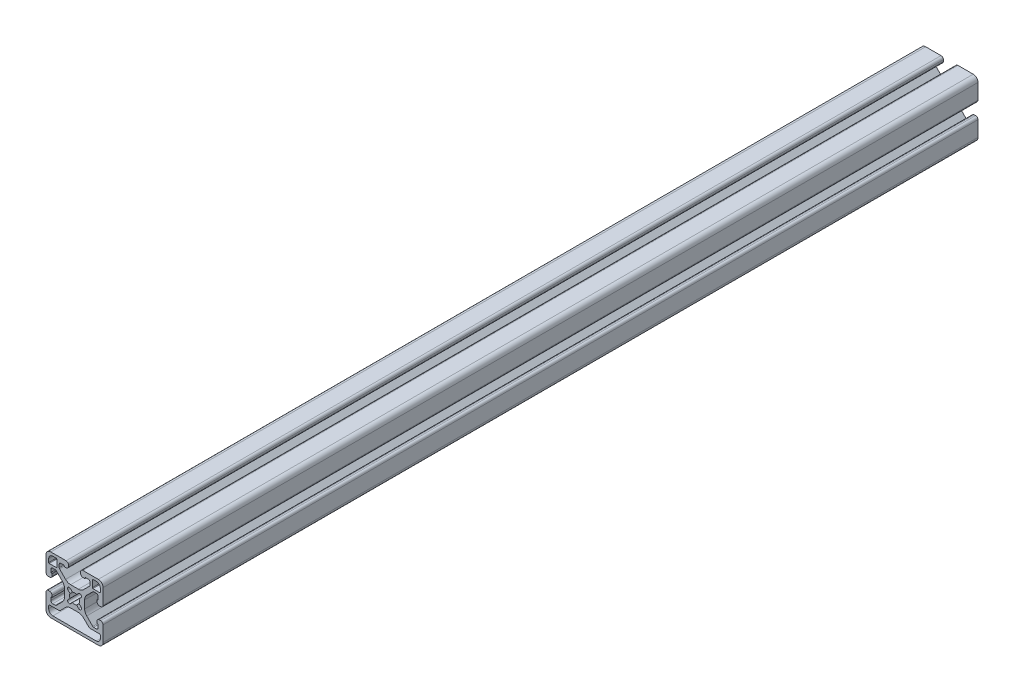
from build123d import *

# Parameters (mm, degrees)
EXTRUDE1_DEPTH     = 292.1
F_7060_LEFT_D      = 6.6548
F_7060_LEFT_DEPTH  = 20.1168
F_7060_LEFT_TIP    = 1.999303624
F_7060_RIGHT_D     = 6.6548
F_7060_RIGHT_DEPTH = 20.1168
F_7060_RIGHT_TIP   = 1.999303624


with BuildPart() as part:
    # Sketch1 → Extrude1 (new, symmetric)
    with BuildSketch(Plane.XY):
        with BuildLine():
            Line((-15.8242, 7.239), (-15.8242, 9.017))
            ThreePointArc((-15.8242, 9.017), (-15.452225612, 9.915025612), (-14.5542, 10.287))
            Line((-14.5542, 10.287), (-12.810497326, 10.287))
            ThreePointArc((-12.810497326, 10.287), (-12.470291755, 10.219328904), (-12.181879398, 10.026617928))
            Line((-12.181879398, 10.026617928), (-8.129198975, 5.973937506))
            ThreePointArc((-8.129198975, 5.973937506), (-7.09957176, 4.432991483), (-6.738014764, 2.615321716))
            Line((-6.738014764, 2.615321716), (-6.738014764, -2.615321716))
            ThreePointArc((-6.738014764, -2.615321716), (-7.09957176, -4.432991483), (-8.129198975, -5.973937506))
            Line((-8.129198975, -5.973937506), (-12.181879398, -10.026617928))
            ThreePointArc((-12.181879398, -10.026617928), (-12.470291755, -10.219328904), (-12.810497326, -10.287))
            Line((-12.810497326, -10.287), (-14.5542, -10.287))
            ThreePointArc((-14.5542, -10.287), (-15.452225612, -9.915025612), (-15.8242, -9.017))
            Line((-15.8242, -9.017), (-15.8242, -7.239))
            ThreePointArc((-15.8242, -7.239), (-15.712607684, -6.969592316), (-15.4432, -6.858))
            Line((-15.4432, -6.858), (-14.986, -6.858))
            Line((-14.986, -6.858), (-14.986, -5.6388))
            ThreePointArc((-14.986, -5.6388), (-15.447248241, -4.525248241), (-16.5608, -4.064))
            Line((-16.5608, -4.064), (-17.4752, -4.064))
            ThreePointArc((-17.4752, -4.064), (-18.588751759, -4.525248241), (-19.05, -5.6388))
            Line((-19.05, -5.6388), (-19.05, -15.875))
            ThreePointArc((-19.05, -15.875), (-18.12006403, -18.12006403), (-15.875, -19.05))
            Line((-15.875, -19.05), (15.875, -19.05))
            ThreePointArc((15.875, -19.05), (18.12006403, -18.12006403), (19.05, -15.875))
            Line((19.05, -15.875), (19.05, -5.6388))
            ThreePointArc((19.05, -5.6388), (18.588751759, -4.525248241), (17.4752, -4.064))
            Line((17.4752, -4.064), (16.5608, -4.064))
            ThreePointArc((16.5608, -4.064), (15.447248241, -4.525248241), (14.986, -5.6388))
            Line((14.986, -5.6388), (14.986, -6.858))
            Line((14.986, -6.858), (15.4432, -6.858))
            ThreePointArc((15.4432, -6.858), (15.712607684, -6.969592316), (15.8242, -7.239))
            Line((15.8242, -7.239), (15.8242, -9.017))
            ThreePointArc((15.8242, -9.017), (15.452225612, -9.915025612), (14.5542, -10.287))
            Line((14.5542, -10.287), (12.810497326, -10.287))
            ThreePointArc((12.810497326, -10.287), (12.470291755, -10.219328904), (12.181879398, -10.026617928))
            Line((12.181879398, -10.026617928), (8.129198975, -5.973937506))
            ThreePointArc((8.129198975, -5.973937506), (7.09957176, -4.432991483), (6.738014764, -2.615321716))
            Line((6.738014764, -2.615321716), (6.738014764, 2.615321716))
            ThreePointArc((6.738014764, 2.615321716), (7.09957176, 4.432991483), (8.129198975, 5.973937506))
            Line((8.129198975, 5.973937506), (12.181879398, 10.026617928))
            ThreePointArc((12.181879398, 10.026617928), (12.470291755, 10.219328904), (12.810497326, 10.287))
            Line((12.810497326, 10.287), (14.5542, 10.287))
            ThreePointArc((14.5542, 10.287), (15.452225612, 9.915025612), (15.8242, 9.017))
            Line((15.8242, 9.017), (15.8242, 7.239))
            ThreePointArc((15.8242, 7.239), (15.712607684, 6.969592316), (15.4432, 6.858))
            Line((15.4432, 6.858), (14.986, 6.858))
            Line((14.986, 6.858), (14.986, 5.6388))
            ThreePointArc((14.986, 5.6388), (15.447248241, 4.525248241), (16.5608, 4.064))
            Line((16.5608, 4.064), (17.4752, 4.064))
            ThreePointArc((17.4752, 4.064), (18.588751759, 4.525248241), (19.05, 5.6388))
            Line((19.05, 5.6388), (19.05, 15.875))
            ThreePointArc((19.05, 15.875), (18.12006403, 18.12006403), (15.875, 19.05))
            Line((15.875, 19.05), (5.6388, 19.05))
            ThreePointArc((5.6388, 19.05), (4.525248241, 18.588751759), (4.064, 17.4752))
            Line((4.064, 17.4752), (4.064, 16.5608))
            ThreePointArc((4.064, 16.5608), (4.525248241, 15.447248241), (5.6388, 14.986))
            Line((5.6388, 14.986), (6.858, 14.986))
            Line((6.858, 14.986), (6.858, 15.4432))
            ThreePointArc((6.858, 15.4432), (6.969592316, 15.712607684), (7.239, 15.8242))
            Line((7.239, 15.8242), (9.017, 15.8242))
            ThreePointArc((9.017, 15.8242), (9.915025612, 15.452225612), (10.287, 14.5542))
            Line((10.287, 14.5542), (10.287, 12.810497326))
            ThreePointArc((10.287, 12.810497326), (10.219328904, 12.470291755), (10.026617928, 12.181879398))
            Line((10.026617928, 12.181879398), (5.973937506, 8.129198975))
            ThreePointArc((5.973937506, 8.129198975), (4.432991483, 7.09957176), (2.615321716, 6.738014764))
            Line((2.615321716, 6.738014764), (-2.615321716, 6.738014764))
            ThreePointArc((-2.615321716, 6.738014764), (-4.432991483, 7.09957176), (-5.973937506, 8.129198975))
            Line((-5.973937506, 8.129198975), (-10.026617928, 12.181879398))
            ThreePointArc((-10.026617928, 12.181879398), (-10.219328904, 12.470291755), (-10.287, 12.810497326))
            Line((-10.287, 12.810497326), (-10.287, 14.5542))
            ThreePointArc((-10.287, 14.5542), (-9.915025612, 15.452225612), (-9.017, 15.8242))
            Line((-9.017, 15.8242), (-7.239, 15.8242))
            ThreePointArc((-7.239, 15.8242), (-6.969592316, 15.712607684), (-6.858, 15.4432))
            Line((-6.858, 15.4432), (-6.858, 14.986))
            Line((-6.858, 14.986), (-5.6388, 14.986))
            ThreePointArc((-5.6388, 14.986), (-4.525248241, 15.447248241), (-4.064, 16.5608))
            Line((-4.064, 16.5608), (-4.064, 17.4752))
            ThreePointArc((-4.064, 17.4752), (-4.525248241, 18.588751759), (-5.6388, 19.05))
            Line((-5.6388, 19.05), (-15.875, 19.05))
            ThreePointArc((-15.875, 19.05), (-18.12006403, 18.12006403), (-19.05, 15.875))
            Line((-19.05, 15.875), (-19.05, 5.6388))
            ThreePointArc((-19.05, 5.6388), (-18.588751759, 4.525248241), (-17.4752, 4.064))
            Line((-17.4752, 4.064), (-16.5608, 4.064))
            ThreePointArc((-16.5608, 4.064), (-15.447248241, 4.525248241), (-14.986, 5.6388))
            Line((-14.986, 5.6388), (-14.986, 6.858))
            Line((-14.986, 6.858), (-15.4432, 6.858))
            ThreePointArc((-15.4432, 6.858), (-15.712607684, 6.969592316), (-15.8242, 7.239))
        make_face()
        with BuildLine():
            Line((-2.615321716, -6.738014764), (2.615321716, -6.738014764))
            ThreePointArc((2.615321716, -6.738014764), (4.432991483, -7.09957176), (5.973937506, -8.129198975))
            Line((5.973937506, -8.129198975), (9.686553898, -11.841815367))
            ThreePointArc((9.686553898, -11.841815367), (9.93376449, -12.006996204), (10.225369265, -12.065))
            Line((10.225369265, -12.065), (16.51, -12.065))
            ThreePointArc((16.51, -12.065), (17.048815367, -12.288184633), (17.272, -12.827))
            Line((17.272, -12.827), (17.272, -14.478))
            ThreePointArc((17.272, -14.478), (16.453656347, -16.453656347), (14.478, -17.272))
            Line((14.478, -17.272), (-14.478, -17.272))
            ThreePointArc((-14.478, -17.272), (-16.453656347, -16.453656347), (-17.272, -14.478))
            Line((-17.272, -14.478), (-17.272, -12.827))
            ThreePointArc((-17.272, -12.827), (-17.048815367, -12.288184633), (-16.51, -12.065))
            Line((-16.51, -12.065), (-10.225369265, -12.065))
            ThreePointArc((-10.225369265, -12.065), (-9.93376449, -12.006996204), (-9.686553898, -11.841815367))
            Line((-9.686553898, -11.841815367), (-5.973937506, -8.129198975))
            ThreePointArc((-5.973937506, -8.129198975), (-4.432991483, -7.09957176), (-2.615321716, -6.738014764))
        make_face(mode=Mode.SUBTRACT)
        with BuildLine():
            Line((16.8656, 11.8618), (12.2428, 11.8618))
            ThreePointArc((12.2428, 11.8618), (11.973392316, 11.973392316), (11.8618, 12.2428))
            Line((11.8618, 12.2428), (11.8618, 16.8656))
            ThreePointArc((11.8618, 16.8656), (11.973392316, 17.135007684), (12.2428, 17.2466))
            Line((12.2428, 17.2466), (14.4526, 17.2466))
            ThreePointArc((14.4526, 17.2466), (16.428256347, 16.428256347), (17.2466, 14.4526))
            Line((17.2466, 14.4526), (17.2466, 12.2428))
            ThreePointArc((17.2466, 12.2428), (17.135007684, 11.973392316), (16.8656, 11.8618))
        make_face(mode=Mode.SUBTRACT)
        with BuildLine():
            Line((-11.8618, 16.8656), (-11.8618, 12.2428))
            ThreePointArc((-11.8618, 12.2428), (-11.973392316, 11.973392316), (-12.2428, 11.8618))
            Line((-12.2428, 11.8618), (-16.8656, 11.8618))
            ThreePointArc((-16.8656, 11.8618), (-17.135007684, 11.973392316), (-17.2466, 12.2428))
            Line((-17.2466, 12.2428), (-17.2466, 14.4526))
            ThreePointArc((-17.2466, 14.4526), (-16.428256347, 16.428256347), (-14.4526, 17.2466))
            Line((-14.4526, 17.2466), (-12.2428, 17.2466))
            ThreePointArc((-12.2428, 17.2466), (-11.973392316, 17.135007684), (-11.8618, 16.8656))
        make_face(mode=Mode.SUBTRACT)
        with BuildLine():
            Line((1.401430967, 3.017877069), (2.722376949, 4.338823051))
            ThreePointArc((2.722376949, 4.338823051), (4.338823051, 4.338823051), (4.338823051, 2.722376949))
            Line((4.338823051, 2.722376949), (3.017877069, 1.401430967))
            ThreePointArc((3.017877069, 1.401430967), (3.3274, 0), (3.017877069, -1.401430967))
            Line((3.017877069, -1.401430967), (4.338823051, -2.722376949))
            ThreePointArc((4.338823051, -2.722376949), (4.338823051, -4.338823051), (2.722376949, -4.338823051))
            Line((2.722376949, -4.338823051), (1.401430967, -3.017877069))
            ThreePointArc((1.401430967, -3.017877069), (0, -3.3274), (-1.401430967, -3.017877069))
            Line((-1.401430967, -3.017877069), (-2.722376949, -4.338823051))
            ThreePointArc((-2.722376949, -4.338823051), (-4.338823051, -4.338823051), (-4.338823051, -2.722376949))
            Line((-4.338823051, -2.722376949), (-3.017877069, -1.401430967))
            ThreePointArc((-3.017877069, -1.401430967), (-3.3274, 0), (-3.017877069, 1.401430967))
            Line((-3.017877069, 1.401430967), (-4.338823051, 2.722376949))
            ThreePointArc((-4.338823051, 2.722376949), (-4.338823051, 4.338823051), (-2.722376949, 4.338823051))
            Line((-2.722376949, 4.338823051), (-1.401430967, 3.017877069))
            ThreePointArc((-1.401430967, 3.017877069), (0, 3.3274), (1.401430967, 3.017877069))
        make_face(mode=Mode.SUBTRACT)
    extrude(amount=EXTRUDE1_DEPTH, both=True)

    # 7060-LEFT
    with Locations(Plane.XY.offset(292.1)):
        with Locations((0, 0)):
            Hole(F_7060_LEFT_D / 2, depth=F_7060_LEFT_DEPTH)
            with Locations((0, 0, -(F_7060_LEFT_DEPTH + F_7060_LEFT_TIP / 2))):  # 118° drill point
                Cone(0, F_7060_LEFT_D / 2, F_7060_LEFT_TIP, mode=Mode.SUBTRACT)

    # 7060-RIGHT
    with Locations(Plane(origin=(0, 0, -292.1), x_dir=(-1, 0, 0), z_dir=(0, 0, -1))):
        with Locations((0, 0)):
            Hole(F_7060_RIGHT_D / 2, depth=F_7060_RIGHT_DEPTH)
            with Locations((0, 0, -(F_7060_RIGHT_DEPTH + F_7060_RIGHT_TIP / 2))):  # 118° drill point
                Cone(0, F_7060_RIGHT_D / 2, F_7060_RIGHT_TIP, mode=Mode.SUBTRACT)


solid = part.part
